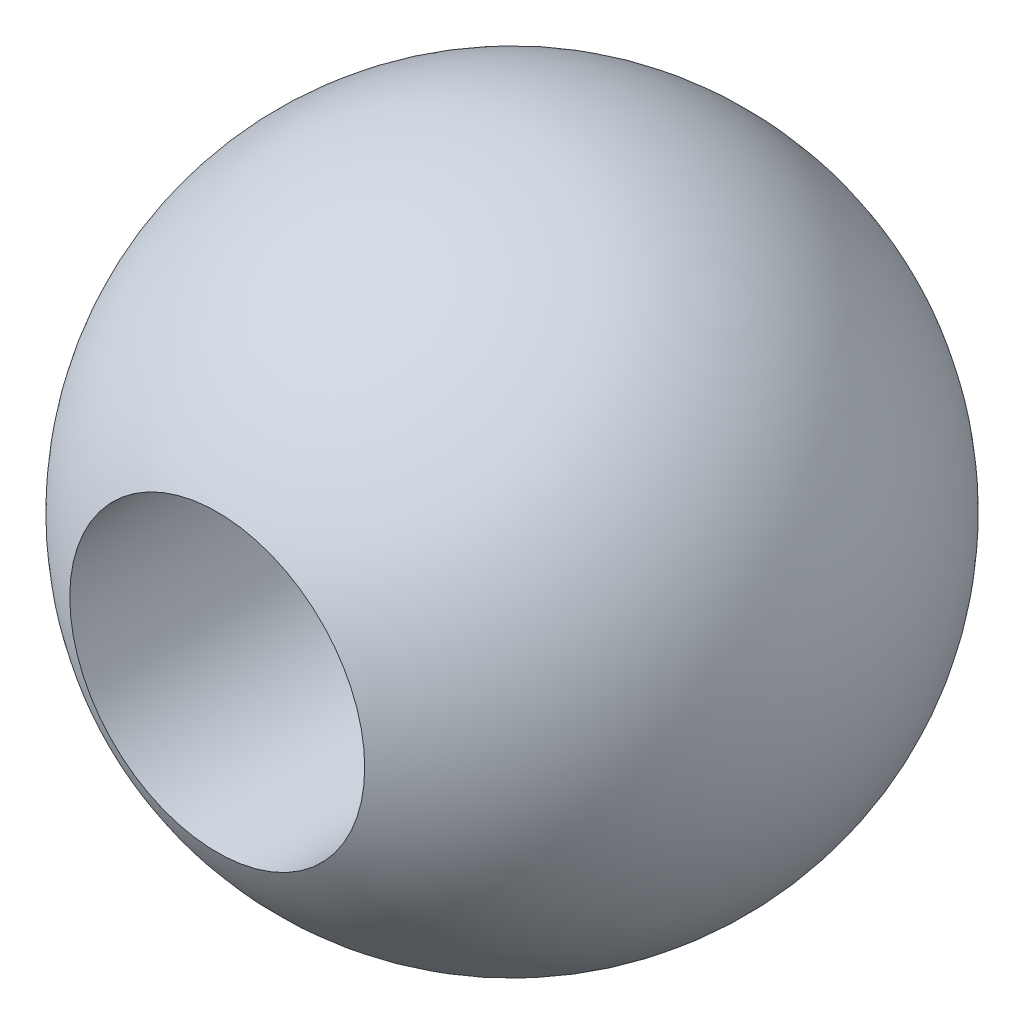
from build123d import *

# Parameters (mm, degrees)
SKETCH3_R          = 3.355305716
CUT_EXTRUDE2_DEPTH = 59


with BuildPart() as part:
    # Sketch1 → Revolve1 (revolve)
    with BuildSketch(Plane.XY):
        with BuildLine():
            Line((0, 7.5), (0, -7.5))
            ThreePointArc((0, -7.5), (-7.5, 0), (0, 7.5))
        make_face()
    revolve(axis=Axis((0, 7.5, 0), (0, -1, 0)))

    # Sketch3 → Cut-Extrude2 (cut)
    with BuildSketch(Plane.XY.offset(30)):
        with Locations(Location((0, 0, 0), (0, 0, 180))):
            Circle(SKETCH3_R)
    extrude(amount=-CUT_EXTRUDE2_DEPTH, mode=Mode.SUBTRACT)


solid = part.part
